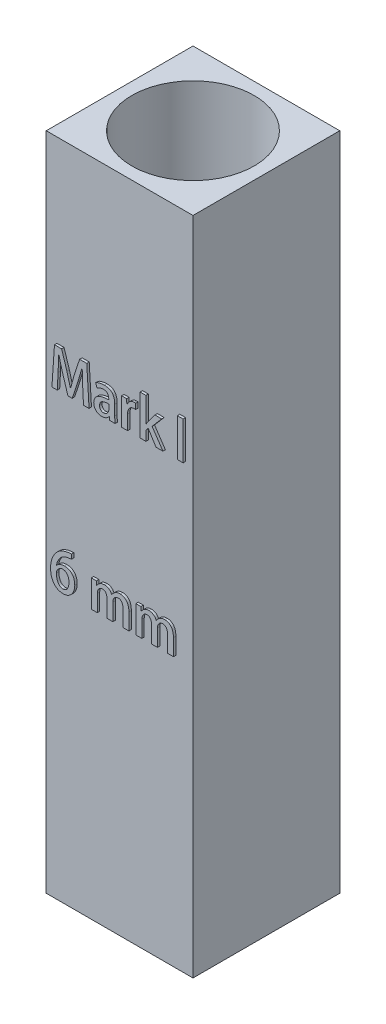
from build123d import *

# Parameters (mm, degrees)
CROQUIS1_W              = 6
CROQUIS1_H              = 6
CROQUIS1_R              = 2.5
SALIENTE_EXTRUIR1_DEPTH = 27
CROQUIS2_2_W            = 0.238171994
CROQUIS2_2_H            = 1.552222222
SALIENTE_EXTRUIR2_DEPTH = 0.1


with BuildPart() as part:
    # Croquis1 → Saliente-Extruir1 (new body)
    with BuildSketch(Plane(origin=(0, 0, 0), x_dir=(1, 0, 0), z_dir=(0, 1, 0))):
        Rectangle(CROQUIS1_W, CROQUIS1_H)
        Circle(CROQUIS1_R, mode=Mode.SUBTRACT)
    extrude(amount=SALIENTE_EXTRUIR1_DEPTH)

    # Croquis2<2> → Saliente-Extruir2 (add)
    # profile 1 of 8: a face of its own
    with BuildSketch(Plane.XY.offset(3)):
        with BuildLine():
            Line((-1.243105258, 19.691333526), (-1.53583583, 19.691333526))
            Line((-1.53583583, 19.691333526), (-1.759926131, 19.009160095))
            add(Edge.make_bspline(
                [(-1.759926131, 19.009160095), (-1.774503705, 18.961969088), (-1.803038041, 18.869596785), (-1.842147714, 18.733006523), (-1.876798216, 18.601332234), (-1.897467062, 18.514910223), (-1.907577821, 18.472634418)],
                knots=[0, 0, 0, 0, 1.06482216, 2.08429696, 3.06287894, 4, 4, 4, 4], degree=3))
            Line((-1.907577821, 18.472634418), (-1.913357327, 18.472634418))
            add(Edge.make_bspline(
                [(-1.913357327, 18.472634418), (-1.923287511, 18.515304168), (-1.943489707, 18.6021125), (-1.977509829, 18.733741597), (-2.014265856, 18.869354234), (-2.041158045, 18.960661279), (-2.054821906, 19.007054186)],
                knots=[0, 0, 0, 0, 0.950771496, 1.934271678, 2.950408035, 4, 4, 4, 4], degree=3))
            Line((-2.054821906, 19.007054186), (-2.272709341, 19.691333526))
            Line((-2.272709341, 19.691333526), (-2.563421082, 19.691333526))
            Line((-2.563421082, 19.691333526), (-2.668436986, 18.141662341))
            Line((-2.668436986, 18.141662341), (-2.450366516, 18.141662341))
            Line((-2.450366516, 18.141662341), (-2.41604638, 18.777478553))
            add(Edge.make_bspline(
                [(-2.41604638, 18.777478553), (-2.412948778, 18.833172848), (-2.406698639, 18.945549135), (-2.400615986, 19.086056436), (-2.395173591, 19.197982767), (-2.392536137, 19.279250732), (-2.389596416, 19.35755157), (-2.388544482, 19.408698047), (-2.388027645, 19.433827381)],
                knots=[0, 0, 0, 0, 1.528265809, 3.083634274, 3.853229214, 4.59840858, 5.311368824, 6, 6, 6, 6], degree=3))
            Line((-2.388027645, 19.433827381), (-2.381726244, 19.433850583))
            add(Edge.make_bspline(
                [(-2.381726244, 19.433850583), (-2.371395386, 19.385870079), (-2.350437115, 19.288531757), (-2.313337232, 19.14176167), (-2.272564393, 18.991726175), (-2.241928921, 18.891313412), (-2.226411129, 18.840451317)],
                knots=[0, 0, 0, 0, 0.959753872, 1.947058171, 2.960122984, 4, 4, 4, 4], degree=3))
            Line((-2.226411129, 18.840451317), (-2.014298904, 18.155854314))
            Line((-2.014298904, 18.155854314), (-1.838660561, 18.155854314))
            Line((-1.838660561, 18.155854314), (-1.608513766, 18.854705734))
            add(Edge.make_bspline(
                [(-1.608513766, 18.854705734), (-1.592363414, 18.904162216), (-1.560380634, 19.00210162), (-1.51600407, 19.148281273), (-1.474748025, 19.291806547), (-1.449552822, 19.386852984), (-1.437100704, 19.433827381)],
                knots=[0, 0, 0, 0, 1.033513873, 2.046682856, 3.034620343, 4, 4, 4, 4], degree=3))
            Line((-1.437100704, 19.433827381), (-1.43085659, 19.433850583))
            add(Edge.make_bspline(
                [(-1.43085659, 19.433850583), (-1.430953507, 19.408910817), (-1.431151116, 19.35805965), (-1.430144835, 19.28051514), (-1.428514077, 19.20033124), (-1.424351207, 19.090633995), (-1.418525422, 18.953360161), (-1.413291565, 18.843675712), (-1.410702362, 18.789414522)],
                knots=[0, 0, 0, 0, 0.69615936, 1.419440619, 2.164688967, 2.934803833, 4.483639269, 6, 6, 6, 6], degree=3))
            Line((-1.410702362, 18.789414522), (-1.376348139, 18.141662341))
            Line((-1.376348139, 18.141662341), (-1.150239007, 18.141662341))
            Line((-1.150239007, 18.141662341), (-1.243105258, 19.691333526))
        make_face()
    # profile 2 of 8: a face of its own
    with BuildSketch(Plane.XY.offset(3)):
        with BuildLine():
            add(Edge.make_bspline(
                [(-0.100758256, 18.817759799), (-0.100739773, 18.833347282), (-0.100703376, 18.864042223), (-0.104324864, 18.909261775), (-0.110699636, 18.952692823), (-0.120020741, 18.994333635), (-0.132742356, 19.034016589), (-0.148219231, 19.071940837), (-0.166862147, 19.107964119), (-0.188351457, 19.142114859), (-0.213892812, 19.173526007), (-0.244145496, 19.201120016), (-0.279192974, 19.224438404), (-0.31896107, 19.243469367), (-0.363276923, 19.258660002), (-0.412114621, 19.269965646), (-0.465526352, 19.277361289), (-0.502672249, 19.278797873), (-0.521958181, 19.279543738)],
                knots=[0, 0, 0, 0, 1.04529413, 2.058397975, 3.039753549, 3.988049356, 4.917306062, 5.832005784, 6.732558164, 7.634995369, 8.534400609, 9.439717093, 10.371077683, 11.347885902, 12.389132223, 13.507522911, 14.705920534, 16, 16, 16, 16], degree=3))
            add(Edge.make_bspline(
                [(-0.521958181, 19.279543738), (-0.539763684, 19.279069767), (-0.574855052, 19.278135656), (-0.626406557, 19.273142892), (-0.675926526, 19.265018234), (-0.722843684, 19.253459127), (-0.766893023, 19.240088594), (-0.807531963, 19.225224612), (-0.844382305, 19.208669369), (-0.866891698, 19.195734993), (-0.877749168, 19.189496061)],
                knots=[0, 0, 0, 0, 1.151566781, 2.269526023, 3.346377101, 4.393757963, 5.391790339, 6.321988655, 7.190606464, 8, 8, 8, 8], degree=3))
            Line((-0.877749168, 19.189496061), (-0.827929172, 19.031316256))
            add(Edge.make_bspline(
                [(-0.827929172, 19.031316256), (-0.818518559, 19.037359562), (-0.79953562, 19.049550023), (-0.769045627, 19.065312965), (-0.736909363, 19.079516835), (-0.702945566, 19.090955508), (-0.668157306, 19.100794685), (-0.632762856, 19.107805863), (-0.596954026, 19.112036125), (-0.57300624, 19.112638227), (-0.560969065, 19.112940869)],
                knots=[0, 0, 0, 0, 0.947728913, 1.911743672, 2.906591377, 3.923705885, 4.947352295, 5.969890554, 6.979580645, 8, 8, 8, 8], degree=3))
            add(Edge.make_bspline(
                [(-0.560969065, 19.112940869), (-0.548619984, 19.112126351), (-0.525048994, 19.110571661), (-0.491779036, 19.104263938), (-0.462255406, 19.095878172), (-0.436252729, 19.085213272), (-0.414224266, 19.07119136), (-0.395800204, 19.054780822), (-0.381225064, 19.03557404), (-0.368278385, 19.006862446), (-0.357184454, 18.970405505), (-0.347402278, 18.927885709), (-0.342887998, 18.887166526), (-0.344170608, 18.860889493), (-0.344795975, 18.848077504)],
                knots=[0, 0, 0, 0, 1.124941475, 2.147203117, 3.073276344, 3.914150165, 4.693859246, 5.436944029, 6.148486199, 6.868538222, 8.288979618, 9.609682438, 10.834544209, 12, 12, 12, 12], degree=3))
            add(Edge.make_bspline(
                [(-0.344795975, 18.848077504), (-0.367484742, 18.847793001), (-0.411831212, 18.847236924), (-0.476588911, 18.842998533), (-0.537682863, 18.835032947), (-0.595163267, 18.824143926), (-0.64923427, 18.810699823), (-0.699533799, 18.793185909), (-0.74643407, 18.773039972), (-0.789591754, 18.749708127), (-0.828620699, 18.723102195), (-0.862637975, 18.692798312), (-0.891321074, 18.658896681), (-0.9155088, 18.62203478), (-0.933912522, 18.581262884), (-0.947792081, 18.537395451), (-0.956370999, 18.489967105), (-0.957911352, 18.457221869), (-0.958704084, 18.440369778)],
                knots=[0, 0, 0, 0, 1.312583045, 2.565517338, 3.751913568, 4.874585872, 5.948775456, 6.97196923, 7.952367169, 8.899011352, 9.80588498, 10.679130641, 11.525793372, 12.368308044, 13.221239438, 14.104974037, 15.024739096, 16, 16, 16, 16], degree=3))
            add(Edge.make_bspline(
                [(-0.958704084, 18.440369778), (-0.958279735, 18.429409478), (-0.957447111, 18.407904049), (-0.953439331, 18.376232764), (-0.946178959, 18.345993553), (-0.937028287, 18.316766551), (-0.924476437, 18.289057162), (-0.909514362, 18.262676674), (-0.892073498, 18.237429503), (-0.871909761, 18.21387715), (-0.849483179, 18.192019903), (-0.824299395, 18.173257681), (-0.797171402, 18.157052786), (-0.767946898, 18.143386876), (-0.736303007, 18.132943931), (-0.702552325, 18.125010036), (-0.666504369, 18.120026571), (-0.641743704, 18.118892734), (-0.629018124, 18.118310006)],
                knots=[0, 0, 0, 0, 1.019558823, 2.000497171, 2.961865832, 3.90763667, 4.843526869, 5.78386522, 6.724423229, 7.691661655, 8.662438953, 9.629634663, 10.603980382, 11.596308817, 12.622532153, 13.696327026, 14.81604254, 16, 16, 16, 16], degree=3))
            add(Edge.make_bspline(
                [(-0.629018124, 18.118310006), (-0.61264805, 18.118865547), (-0.580673264, 18.119950655), (-0.534513933, 18.128623757), (-0.491080825, 18.140921365), (-0.451201641, 18.158999118), (-0.414991177, 18.181101137), (-0.382021185, 18.2057859), (-0.352929271, 18.233708521), (-0.336724437, 18.254779449), (-0.328663655, 18.265260776)],
                knots=[0, 0, 0, 0, 1.130657597, 2.208452709, 3.237069398, 4.244418774, 5.223812689, 6.164576675, 7.087004055, 8, 8, 8, 8], degree=3))
            Line((-0.328663655, 18.265260776), (-0.3220592, 18.265318351))
            Line((-0.3220592, 18.265318351), (-0.305198176, 18.13987123))
            Line((-0.305198176, 18.13987123), (-0.084538858, 18.13987123))
            add(Edge.make_bspline(
                [(-0.084538858, 18.13987123), (-0.087703938, 18.158850164), (-0.094387748, 18.198928641), (-0.098553622, 18.262467157), (-0.100837119, 18.330648578), (-0.10097902, 18.377499617), (-0.101051284, 18.401358895)],
                knots=[0, 0, 0, 0, 0.879539962, 1.857355241, 2.908840502, 4, 4, 4, 4], degree=3))
            Line((-0.101051284, 18.401358895), (-0.100758256, 18.817759799))
        make_face()
        with BuildLine():
            add(Edge.make_bspline(
                [(-0.338929963, 18.514069733), (-0.339371797, 18.505816524), (-0.340231548, 18.489756839), (-0.343924426, 18.466308526), (-0.348963362, 18.444023954), (-0.356554839, 18.42301308), (-0.365504124, 18.402939642), (-0.376798214, 18.384174666), (-0.389718323, 18.366376051), (-0.404706047, 18.350100626), (-0.420944917, 18.335199447), (-0.438420368, 18.32226415), (-0.456587202, 18.310987342), (-0.475909169, 18.301872267), (-0.496194495, 18.294439671), (-0.517553822, 18.289264654), (-0.539851213, 18.285967026), (-0.554993736, 18.285269295), (-0.562728954, 18.284912875)],
                knots=[0, 0, 0, 0, 1.1127689, 2.165305488, 3.194083487, 4.185588777, 5.169981375, 6.15040018, 7.13046498, 8.12816315, 9.12586132, 10.095335325, 11.053196287, 12.001774197, 12.968470205, 13.958837393, 14.957317833, 16, 16, 16, 16], degree=3))
            add(Edge.make_bspline(
                [(-0.562728954, 18.284912875), (-0.573154956, 18.285239843), (-0.593577379, 18.285880307), (-0.622849474, 18.2946148), (-0.649773059, 18.308312857), (-0.674150955, 18.327453399), (-0.694562833, 18.352948212), (-0.70918768, 18.384928439), (-0.718234509, 18.422875733), (-0.719543136, 18.450189505), (-0.720239061, 18.464714916)],
                knots=[0, 0, 0, 0, 0.925162071, 1.812204857, 2.691873356, 3.602553412, 4.549923018, 5.56994314, 6.707700436, 8, 8, 8, 8], degree=3))
            add(Edge.make_bspline(
                [(-0.720239061, 18.464714916), (-0.719310255, 18.476377608), (-0.717516348, 18.498903076), (-0.710939574, 18.531156202), (-0.700200796, 18.560193715), (-0.686429825, 18.586246768), (-0.669258814, 18.609393378), (-0.648007519, 18.628738379), (-0.623750563, 18.645518844), (-0.586423919, 18.662613003), (-0.536106387, 18.678760546), (-0.473048416, 18.692622909), (-0.406968805, 18.700130184), (-0.362119208, 18.700013197), (-0.339222992, 18.699953474)],
                knots=[0, 0, 0, 0, 0.831751151, 1.606454387, 2.332498033, 3.02628555, 3.696675427, 4.370806108, 5.061344671, 5.786088267, 7.281491765, 8.811961156, 10.372470837, 12, 12, 12, 12], degree=3))
            Line((-0.339222992, 18.699953474), (-0.338929963, 18.514069733))
        make_face(mode=Mode.SUBTRACT)
    # profile 3 of 8: a face of its own
    with BuildSketch(Plane.XY.offset(3)):
        with BuildLine():
            add(Edge.make_bspline(
                [(0.751277735, 19.273806338), (0.741733822, 19.275463651), (0.722241357, 19.278848542), (0.702461024, 19.279308821), (0.69236555, 19.279543738)],
                knots=[0, 0, 0, 0, 0.97924127, 2, 2, 2, 2], degree=3))
            add(Edge.make_bspline(
                [(0.69236555, 19.279543738), (0.677041737, 19.278706709), (0.646649215, 19.277046586), (0.602157925, 19.265098289), (0.559859382, 19.245645191), (0.519748189, 19.219466361), (0.482560598, 19.187026209), (0.450650863, 19.147674619), (0.422706361, 19.10301482), (0.409218529, 19.069869394), (0.402277103, 19.052811312)],
                knots=[0, 0, 0, 0, 0.938175605, 1.860732817, 2.801619752, 3.780189859, 4.786007179, 5.811395864, 6.873648904, 8, 8, 8, 8], degree=3))
            Line((0.402277103, 19.052811312), (0.394064285, 19.052862299))
            Line((0.394064285, 19.052862299), (0.385851468, 19.255732239))
            Line((0.385851468, 19.255732239), (0.178580658, 19.255732239))
            add(Edge.make_bspline(
                [(0.178580658, 19.255732239), (0.179929699, 19.229747095), (0.182683519, 19.176703171), (0.184764449, 19.094861948), (0.186412593, 19.007941051), (0.186402548, 18.948098882), (0.186397328, 18.917006508)],
                knots=[0, 0, 0, 0, 0.921405029, 1.880880017, 2.898962507, 4, 4, 4, 4], degree=3))
            Line((0.186397328, 18.917006508), (0.186690357, 18.140521163))
            Line((0.186690357, 18.140521163), (0.424862351, 18.140521163))
            Line((0.424862351, 18.140521163), (0.424862351, 18.732529189))
            add(Edge.make_bspline(
                [(0.424862351, 18.732529189), (0.425227549, 18.744554826), (0.425938591, 18.767968787), (0.429042586, 18.802198873), (0.434636496, 18.834442383), (0.442244094, 18.864856481), (0.451959425, 18.89339884), (0.463546958, 18.920254795), (0.477783639, 18.944852342), (0.493604518, 18.967681884), (0.511459007, 18.988076857), (0.530809444, 19.006277215), (0.552300155, 19.021240054), (0.575090356, 19.034026553), (0.599761053, 19.043558857), (0.625708699, 19.051114824), (0.653409693, 19.055443295), (0.672406187, 19.056225348), (0.682099528, 19.056624406)],
                knots=[0, 0, 0, 0, 1.241840886, 2.417868999, 3.544527356, 4.616704577, 5.650820151, 6.654086497, 7.630544836, 8.5797601, 9.516878827, 10.423948895, 11.314471818, 12.213419717, 13.114913654, 14.038234368, 14.998969914, 16, 16, 16, 16], degree=3))
            add(Edge.make_bspline(
                [(0.682099528, 19.056624406), (0.694348105, 19.056443835), (0.717466493, 19.056103018), (0.740295012, 19.05246747), (0.751028532, 19.050758108)],
                knots=[0, 0, 0, 0, 1.059639438, 2, 2, 2, 2], degree=3))
            Line((0.751028532, 19.050758108), (0.751277735, 19.273806338))
        make_face()
    # profile 4 of 8: a face of its own
    with BuildSketch(Plane.XY.offset(3)):
        with BuildLine():
            Line((1.427149192, 18.796284507), (1.820469592, 19.256900056))
            Line((1.820469592, 19.256900056), (1.542712402, 19.256900056))
            Line((1.542712402, 19.256900056), (1.264955212, 18.883537673))
            add(Edge.make_bspline(
                [(1.264955212, 18.883537673), (1.250285677, 18.862454076), (1.220679155, 18.819902489), (1.193349757, 18.775853538), (1.179561617, 18.753630103)],
                knots=[0, 0, 0, 0, 0.99096644, 2, 2, 2, 2], degree=3))
            Line((1.179561617, 18.753630103), (1.175748523, 18.753672496))
            Line((1.175748523, 18.753672496), (1.175748523, 19.766152889))
            Line((1.175748523, 19.766152889), (0.937576529, 19.766152889))
            Line((0.937576529, 19.766152889), (0.937576529, 18.13884205))
            Line((0.937576529, 18.13884205), (1.175748523, 18.13884205))
            Line((1.175748523, 18.13884205), (1.175748523, 18.54061244))
            Line((1.175748523, 18.54061244), (1.266982637, 18.652215327))
            Line((1.266982637, 18.652215327), (1.587315746, 18.13884205))
            Line((1.587315746, 18.13884205), (1.871155211, 18.13884205))
            Line((1.871155211, 18.13884205), (1.427149192, 18.796284507))
        make_face()
    # profile 5 of 8: a face of its own
    with BuildSketch(Plane.XY.offset(3)):
        with Locations((2.577207024, 18.914953161)):
            Rectangle(CROQUIS2_2_W, CROQUIS2_2_H)
    # profile 6 of 8: a face of its own
    with BuildSketch(Plane.XY.offset(3)):
        with BuildLine():
            add(Edge.make_bspline(
                [(-2.480889026, 11.9222523), (-2.479041686, 11.936342955), (-2.475309643, 11.964809261), (-2.46474607, 12.00713304), (-2.450552354, 12.049422287), (-2.433014341, 12.091776695), (-2.411328979, 12.133761982), (-2.386390526, 12.175876989), (-2.357415313, 12.217777693), (-2.325352855, 12.2597275), (-2.288494636, 12.299522465), (-2.245433982, 12.334410494), (-2.196814745, 12.364126731), (-2.142733216, 12.389046194), (-2.083257409, 12.409257188), (-2.018286905, 12.424262755), (-1.947978563, 12.43501444), (-1.899110741, 12.437813826), (-1.873846606, 12.439261078)],
                knots=[0, 0, 0, 0, 0.777509649, 1.570745206, 2.383233953, 3.218261332, 4.077671974, 4.968127196, 5.896067489, 6.865046429, 7.857167727, 8.857843751, 9.888812526, 10.968872827, 12.111466473, 13.321517165, 14.615253401, 16, 16, 16, 16], degree=3))
            Line((-1.873846606, 12.439261078), (-1.875606782, 12.623902528))
            add(Edge.make_bspline(
                [(-1.875606782, 12.623902528), (-1.902720762, 12.623262343), (-1.956849823, 12.621984308), (-2.037751847, 12.611349791), (-2.118031791, 12.593728685), (-2.184010857, 12.573005662), (-2.235798191, 12.552954572), (-2.27360479, 12.535507933), (-2.310014788, 12.515973979), (-2.345287469, 12.494353075), (-2.379199894, 12.470680539), (-2.411926915, 12.444737484), (-2.44324992, 12.416596699), (-2.463114974, 12.396536412), (-2.473088969, 12.386464394)],
                knots=[0, 0, 0, 0, 1.475963964, 2.94654425, 4.434636167, 5.946695683, 6.706959259, 7.457316209, 8.212361229, 8.955602033, 9.708824246, 10.462949018, 11.228265963, 12, 12, 12, 12], degree=3))
            add(Edge.make_bspline(
                [(-2.473088969, 12.386464394), (-2.482393486, 12.37619807), (-2.501041839, 12.355622038), (-2.52711471, 12.322793764), (-2.55219373, 12.288649487), (-2.575148367, 12.252341118), (-2.59740506, 12.214908142), (-2.617489193, 12.175359017), (-2.636577187, 12.134412089), (-2.654186297, 12.091876025), (-2.670102922, 12.047879005), (-2.683809213, 12.002207453), (-2.69592505, 11.955193025), (-2.705515778, 11.906597509), (-2.71315677, 11.856687228), (-2.718690066, 11.805209017), (-2.722271896, 11.752268806), (-2.722946107, 11.716440951), (-2.723286588, 11.698347613)],
                knots=[0, 0, 0, 0, 0.887076062, 1.777900753, 2.683391647, 3.598700782, 4.527593784, 5.471309146, 6.437764931, 7.420312658, 8.418516269, 9.432655989, 10.472901406, 11.526478087, 12.603278601, 13.705447861, 14.841233787, 16, 16, 16, 16], degree=3))
            add(Edge.make_bspline(
                [(-2.723286588, 11.698347613), (-2.722724699, 11.674278175), (-2.721628386, 11.627315775), (-2.714693561, 11.558738759), (-2.704184634, 11.493854475), (-2.688709355, 11.43294789), (-2.669902859, 11.375660204), (-2.646216637, 11.322488036), (-2.619017122, 11.272762739), (-2.587328444, 11.227442658), (-2.552201435, 11.186378973), (-2.51324497, 11.150707354), (-2.471039565, 11.12023013), (-2.425521531, 11.095176429), (-2.376830571, 11.075307106), (-2.324754515, 11.061510159), (-2.26957391, 11.051982088), (-2.231536898, 11.05055823), (-2.212038698, 11.049828345)],
                knots=[0, 0, 0, 0, 1.244240003, 2.427663509, 3.56025608, 4.639046522, 5.673196192, 6.673439109, 7.644022454, 8.598895837, 9.527068602, 10.432163715, 11.32293322, 12.212023313, 13.112150977, 14.03423449, 14.992326474, 16, 16, 16, 16], degree=3))
            add(Edge.make_bspline(
                [(-2.212038698, 11.049828345), (-2.193914698, 11.0507327), (-2.158455315, 11.052502058), (-2.106919701, 11.061296596), (-2.058270731, 11.073972861), (-2.012713907, 11.09172226), (-1.970313629, 11.114082814), (-1.93091643, 11.141012218), (-1.894622185, 11.172634149), (-1.861757801, 11.208665131), (-1.832232289, 11.247934395), (-1.806239934, 11.289669982), (-1.784512889, 11.333950328), (-1.766628317, 11.380396873), (-1.752470465, 11.429063175), (-1.742316053, 11.479990926), (-1.735633268, 11.533134669), (-1.734701787, 11.569366515), (-1.734228708, 11.587767892)],
                knots=[0, 0, 0, 0, 1.081673944, 2.116281853, 3.112274727, 4.076244858, 5.025922624, 5.965842859, 6.916701973, 7.890887246, 8.869584152, 9.843944007, 10.819490191, 11.807320738, 12.809578423, 13.839044245, 14.902496982, 16, 16, 16, 16], degree=3))
            add(Edge.make_bspline(
                [(-1.734228708, 11.587767892), (-1.734835703, 11.606557434), (-1.736014986, 11.643062197), (-1.742242815, 11.696016437), (-1.75183553, 11.745467961), (-1.764877457, 11.791533184), (-1.782043247, 11.833875783), (-1.802274579, 11.873073448), (-1.826349189, 11.908571776), (-1.853805361, 11.940471334), (-1.884132035, 11.968499322), (-1.916325377, 11.993417126), (-1.951041915, 12.013937788), (-1.987584933, 12.031220688), (-2.026529372, 12.044244293), (-2.067414329, 12.054101656), (-2.11050109, 12.059593828), (-2.139868677, 12.060448879), (-2.154842291, 12.060884843)],
                knots=[0, 0, 0, 0, 1.26296684, 2.453721526, 3.578700088, 4.645529679, 5.665582436, 6.644269457, 7.604699112, 8.541184806, 9.466353035, 10.375777277, 11.271641363, 12.171136678, 13.087489562, 14.026208577, 14.993625547, 16, 16, 16, 16], degree=3))
            add(Edge.make_bspline(
                [(-2.154842291, 12.060884843), (-2.172275559, 12.060268806), (-2.206235737, 12.05906876), (-2.255494634, 12.051277663), (-2.301508132, 12.039128192), (-2.343936731, 12.021996403), (-2.382503427, 12.000943232), (-2.418053102, 11.977912024), (-2.449764296, 11.951708864), (-2.468111319, 11.931936614), (-2.477195378, 11.92214689)],
                knots=[0, 0, 0, 0, 1.156440373, 2.252757208, 3.300703977, 4.307699385, 5.279936465, 6.211868705, 7.114652551, 8, 8, 8, 8], degree=3))
            Line((-2.477195378, 11.92214689), (-2.480889026, 11.9222523))
        make_face()
        with BuildLine():
            add(Edge.make_bspline(
                [(-2.211765148, 11.216431214), (-2.222449864, 11.217027407), (-2.243218733, 11.218186281), (-2.273125424, 11.22460629), (-2.301225848, 11.233961342), (-2.327375495, 11.247249248), (-2.351663278, 11.264118389), (-2.373817424, 11.28467184), (-2.394128901, 11.308638217), (-2.412514649, 11.335935913), (-2.428739235, 11.366112861), (-2.443178471, 11.39855375), (-2.455583506, 11.433229745), (-2.465263589, 11.470306417), (-2.47374491, 11.509396793), (-2.479262766, 11.550901682), (-2.483659234, 11.59452362), (-2.484428704, 11.624420449), (-2.484821565, 11.639684631)],
                knots=[0, 0, 0, 0, 0.915864629, 1.78025069, 2.61227226, 3.447914443, 4.2846901, 5.138616198, 6.030190831, 6.971411356, 7.953766446, 8.962775595, 10.012269494, 11.105795088, 12.244640674, 13.437916411, 14.69189769, 16, 16, 16, 16], degree=3))
            add(Edge.make_bspline(
                [(-2.484821565, 11.639684631), (-2.4843096, 11.648697714), (-2.483291353, 11.666623803), (-2.478760518, 11.692809371), (-2.47236593, 11.718218115), (-2.46322097, 11.742426073), (-2.451848912, 11.765765312), (-2.438960929, 11.788522372), (-2.422620648, 11.809571145), (-2.405120417, 11.830079746), (-2.385558073, 11.848487713), (-2.365391792, 11.865206721), (-2.343968924, 11.878936557), (-2.322063342, 11.890919052), (-2.298904392, 11.899866765), (-2.275234928, 11.907064208), (-2.250616631, 11.911511085), (-2.233956138, 11.912535896), (-2.225531184, 11.913054128)],
                knots=[0, 0, 0, 0, 1.046132762, 2.080649706, 3.076157144, 4.0807274, 5.074684002, 6.085886841, 7.106328067, 8.159075787, 9.209623149, 10.217196229, 11.192086732, 12.15583678, 13.107505917, 14.065368779, 15.02168697, 16, 16, 16, 16], degree=3))
            add(Edge.make_bspline(
                [(-2.225531184, 11.913054128), (-2.215929131, 11.912692739), (-2.197194701, 11.911987637), (-2.169924059, 11.907156747), (-2.144341023, 11.899553238), (-2.12033903, 11.889168919), (-2.097819822, 11.876186314), (-2.076865069, 11.860281438), (-2.057785517, 11.841257094), (-2.040218686, 11.819826245), (-2.024320056, 11.796141632), (-2.010921567, 11.770026009), (-1.999120597, 11.742126429), (-1.989426164, 11.712209119), (-1.98224286, 11.6801642), (-1.976560897, 11.646305495), (-1.973484898, 11.610309196), (-1.972768179, 11.58571958), (-1.972400416, 11.573102146)],
                knots=[0, 0, 0, 0, 0.969557164, 1.891689275, 2.788354305, 3.659703236, 4.526901527, 5.407766989, 6.308555138, 7.241672595, 8.202997831, 9.183555995, 10.201442537, 11.260090598, 12.3547857, 13.515543957, 14.725174941, 16, 16, 16, 16], degree=3))
            add(Edge.make_bspline(
                [(-1.972400416, 11.573102146), (-1.972628062, 11.560285705), (-1.973073665, 11.535198293), (-1.976487066, 11.498496813), (-1.98124193, 11.463576339), (-1.988426948, 11.430599991), (-1.997051695, 11.399444536), (-2.00796272, 11.370204164), (-2.0209569, 11.342910779), (-2.035384732, 11.317410853), (-2.051899003, 11.294403512), (-2.06996039, 11.274082751), (-2.089835617, 11.256914724), (-2.111151464, 11.242589297), (-2.134189549, 11.231465201), (-2.158687824, 11.223121109), (-2.184868058, 11.218167766), (-2.20282845, 11.217019867), (-2.211765148, 11.216431214)],
                knots=[0, 0, 0, 0, 1.284412311, 2.514159745, 3.692212462, 4.814741848, 5.894356042, 6.930111876, 7.938380453, 8.921766342, 9.862780727, 10.771869383, 11.640326944, 12.488361832, 13.338658754, 14.197105583, 15.075459788, 16, 16, 16, 16], degree=3))
        make_face(mode=Mode.SUBTRACT)
    # profile 7 of 8: a face of its own
    with BuildSketch(Plane.XY.offset(3)):
        with BuildLine():
            add(Edge.make_bspline(
                [(0.481178528, 11.752717427), (0.480250218, 11.773330005), (0.478458461, 11.813114954), (0.471908088, 11.870369922), (0.462932743, 11.923044647), (0.449928572, 11.970688456), (0.434305673, 12.013583133), (0.41514704, 12.051523086), (0.392817766, 12.084778382), (0.367147428, 12.113035136), (0.339265255, 12.136538605), (0.311083182, 12.15738016), (0.281954473, 12.174667253), (0.252209031, 12.188977487), (0.221508429, 12.199663032), (0.18997037, 12.206461937), (0.157881868, 12.210979164), (0.136255806, 12.210839133), (0.125387827, 12.210768762)],
                knots=[0, 0, 0, 0, 1.513261231, 2.920790482, 4.225039661, 5.429095985, 6.538902965, 7.568588871, 8.539409605, 9.468669045, 10.358677973, 11.210859535, 12.037483604, 12.839564471, 13.628941055, 14.4154775, 15.203712731, 16, 16, 16, 16], degree=3))
            add(Edge.make_bspline(
                [(0.125387827, 12.210768762), (0.106172097, 12.210010119), (0.068922136, 12.208539477), (0.015398149, 12.1979582), (-0.034067301, 12.181710227), (-0.078938979, 12.158196445), (-0.119501153, 12.128929209), (-0.15716339, 12.095784573), (-0.190846372, 12.057263465), (-0.210072807, 12.028742391), (-0.219843823, 12.014247772)],
                knots=[0, 0, 0, 0, 1.108126197, 2.148118191, 3.136426768, 4.10280475, 5.057637098, 6.016626622, 6.992035069, 8, 8, 8, 8], degree=3))
            Line((-0.219843823, 12.014247772), (-0.223900678, 12.01425522))
            add(Edge.make_bspline(
                [(-0.223900678, 12.01425522), (-0.23051503, 12.028960136), (-0.243458943, 12.057736822), (-0.270221955, 12.096430721), (-0.301804378, 12.130085462), (-0.338126016, 12.158756512), (-0.37865322, 12.181726908), (-0.42302607, 12.19815049), (-0.470614691, 12.208844564), (-0.503616136, 12.210117725), (-0.520491607, 12.210768762)],
                knots=[0, 0, 0, 0, 1.020955632, 1.99795227, 2.96752067, 3.938931661, 4.92195175, 5.909051468, 6.930781959, 8, 8, 8, 8], degree=3))
            add(Edge.make_bspline(
                [(-0.520491607, 12.210768762), (-0.539807301, 12.209702295), (-0.576794642, 12.207660131), (-0.629518562, 12.196764914), (-0.676658377, 12.179323987), (-0.717685666, 12.155042435), (-0.753314912, 12.127031078), (-0.784631271, 12.096943481), (-0.811832558, 12.065039339), (-0.826119994, 12.041630138), (-0.833165302, 12.030086777)],
                knots=[0, 0, 0, 0, 1.224631561, 2.345029053, 3.39800305, 4.394808606, 5.352867572, 6.264332918, 7.144121535, 8, 8, 8, 8], degree=3))
            Line((-0.833165302, 12.030086777), (-0.839171383, 12.030303899))
            Line((-0.839171383, 12.030303899), (-0.851707158, 12.187611206))
            Line((-0.851707158, 12.187611206), (-1.060381526, 12.187611206))
            add(Edge.make_bspline(
                [(-1.060381526, 12.187611206), (-1.059414195, 12.164630929), (-1.057438749, 12.117701485), (-1.055311823, 12.058151312), (-1.053539288, 12.008096905), (-1.053221587, 11.96770734), (-1.052384747, 11.924789497), (-1.052503636, 11.895357949), (-1.052564855, 11.880202858)],
                knots=[0, 0, 0, 0, 1.346187736, 2.749133221, 3.487683855, 4.277464658, 5.113020504, 6, 6, 6, 6], degree=3))
            Line((-1.052564855, 11.880202858), (-1.052271827, 11.077584987))
            Line((-1.052271827, 11.077584987), (-0.814099833, 11.077584987))
            Line((-0.814099833, 11.077584987), (-0.814099833, 11.754744852))
            add(Edge.make_bspline(
                [(-0.814099833, 11.754744852), (-0.813559324, 11.765485168), (-0.812508444, 11.786366936), (-0.808597663, 11.81660408), (-0.80330372, 11.844967147), (-0.795165935, 11.87117417), (-0.785595702, 11.895565824), (-0.774157833, 11.918066953), (-0.760615307, 11.938482205), (-0.745010043, 11.956558115), (-0.728325948, 11.972537102), (-0.71130617, 11.986712516), (-0.693895255, 11.998883128), (-0.675982901, 12.008961095), (-0.657462851, 12.016657906), (-0.638495039, 12.021771267), (-0.619298615, 12.025657705), (-0.606257273, 12.026067311), (-0.599686633, 12.026273683)],
                knots=[0, 0, 0, 0, 1.345028047, 2.615059288, 3.812240957, 4.950008049, 6.042686379, 7.08768926, 8.102172383, 9.099996684, 10.068982838, 10.989984122, 11.868914175, 12.723236376, 13.556990843, 14.370301474, 15.178906315, 16, 16, 16, 16], degree=3))
            add(Edge.make_bspline(
                [(-0.599686633, 12.026273683), (-0.591846108, 12.025870767), (-0.576645118, 12.025089605), (-0.554768506, 12.020925909), (-0.534559479, 12.014442832), (-0.515892796, 12.005589596), (-0.498879057, 11.994378136), (-0.483255932, 11.981073158), (-0.469899453, 11.964975768), (-0.453515011, 11.940681202), (-0.437676673, 11.905380458), (-0.423296398, 11.858643916), (-0.41573985, 11.806236414), (-0.414801199, 11.76964393), (-0.414311609, 11.750557667)],
                knots=[0, 0, 0, 0, 0.755950668, 1.465615932, 2.139074498, 2.796588983, 3.449971736, 4.097964407, 4.76639413, 5.458962618, 6.917416126, 8.473425038, 10.160574856, 12, 12, 12, 12], degree=3))
            Line((-0.414311609, 11.750557667), (-0.414018581, 11.077584987))
            Line((-0.414018581, 11.077584987), (-0.175846873, 11.077584987))
            Line((-0.175846873, 11.077584987), (-0.175846873, 11.766909401))
            add(Edge.make_bspline(
                [(-0.175846873, 11.766909401), (-0.175554103, 11.776824966), (-0.174984418, 11.796119114), (-0.170881518, 11.8241438), (-0.165489614, 11.850682557), (-0.157855297, 11.875498525), (-0.148522616, 11.898676754), (-0.136878517, 11.919868398), (-0.123777742, 11.93970964), (-0.108512652, 11.957434401), (-0.091987327, 11.973288699), (-0.074883714, 11.987319278), (-0.057092262, 11.999193194), (-0.038754834, 12.008995495), (-0.019788319, 12.016662106), (-5.4304e-05, 12.021849928), (0.020042772, 12.025628549), (0.033758242, 12.026058558), (0.040619818, 12.026273683)],
                knots=[0, 0, 0, 0, 1.267233675, 2.465839704, 3.615673463, 4.726804397, 5.780700789, 6.804285049, 7.813184962, 8.815168933, 9.787633234, 10.738404153, 11.639821434, 12.517791614, 13.392909498, 14.248069017, 15.123543946, 16, 16, 16, 16], degree=3))
            add(Edge.make_bspline(
                [(0.040619818, 12.026273683), (0.049137559, 12.025851873), (0.065684121, 12.025032465), (0.089729577, 12.021098881), (0.111710186, 12.013760283), (0.132372537, 12.004978951), (0.150604057, 11.992479055), (0.167585203, 11.978237051), (0.182294019, 11.960789), (0.195418347, 11.941187348), (0.206839253, 11.919420014), (0.216436232, 11.89565541), (0.225012615, 11.870250408), (0.231737634, 11.842871267), (0.236501625, 11.813713104), (0.240506798, 11.782821651), (0.242428206, 11.749996087), (0.242617011, 11.727485343), (0.242713791, 11.715946508)],
                knots=[0, 0, 0, 0, 0.979325905, 1.902438322, 2.786756391, 3.636233264, 4.470958944, 5.315074409, 6.175027208, 7.081388835, 8.020752095, 8.99258041, 10.022434341, 11.098284182, 12.226320848, 13.414468146, 14.674676153, 16, 16, 16, 16], degree=3))
            Line((0.242713791, 11.715946508), (0.243006533, 11.077584987))
            Line((0.243006533, 11.077584987), (0.481178528, 11.077584987))
            Line((0.481178528, 11.077584987), (0.481178528, 11.752717427))
        make_face()
    # profile 8 of 8: a face of its own
    with BuildSketch(Plane.XY.offset(3)):
        with BuildLine():
            add(Edge.make_bspline(
                [(2.302077495, 11.752717427), (2.301149185, 11.773330005), (2.299357428, 11.813114954), (2.292807055, 11.870369922), (2.28383171, 11.923044647), (2.270827539, 11.970688456), (2.25520464, 12.013583133), (2.236046007, 12.051523086), (2.213716733, 12.084778382), (2.188046395, 12.113035136), (2.160164222, 12.136538605), (2.131982149, 12.15738016), (2.10285344, 12.174667253), (2.073107998, 12.188977487), (2.042407396, 12.199663032), (2.010869337, 12.206461937), (1.978780835, 12.210979164), (1.957154773, 12.210839133), (1.946286794, 12.210768762)],
                knots=[0, 0, 0, 0, 1.513261231, 2.920790482, 4.225039661, 5.429095985, 6.538902965, 7.568588871, 8.539409605, 9.468669045, 10.358677973, 11.210859535, 12.037483604, 12.839564471, 13.628941055, 14.4154775, 15.203712731, 16, 16, 16, 16], degree=3))
            add(Edge.make_bspline(
                [(1.946286794, 12.210768762), (1.927071064, 12.210010119), (1.889821103, 12.208539477), (1.836297116, 12.1979582), (1.786831667, 12.181710227), (1.741959988, 12.158196445), (1.701397814, 12.128929209), (1.663735577, 12.095784573), (1.630052595, 12.057263465), (1.61082616, 12.028742391), (1.601055144, 12.014247772)],
                knots=[0, 0, 0, 0, 1.108126197, 2.148118191, 3.136426768, 4.10280475, 5.057637098, 6.016626622, 6.992035069, 8, 8, 8, 8], degree=3))
            Line((1.601055144, 12.014247772), (1.596998289, 12.01425522))
            add(Edge.make_bspline(
                [(1.596998289, 12.01425522), (1.590383937, 12.028960136), (1.577440024, 12.057736822), (1.550677012, 12.096430721), (1.519094589, 12.130085462), (1.482772951, 12.158756512), (1.442245747, 12.181726908), (1.397872897, 12.19815049), (1.350284276, 12.208844564), (1.317282831, 12.210117725), (1.30040736, 12.210768762)],
                knots=[0, 0, 0, 0, 1.020955632, 1.99795227, 2.96752067, 3.938931661, 4.92195175, 5.909051468, 6.930781959, 8, 8, 8, 8], degree=3))
            add(Edge.make_bspline(
                [(1.30040736, 12.210768762), (1.281091666, 12.209702295), (1.244104325, 12.207660131), (1.191380405, 12.196764914), (1.14424059, 12.179323987), (1.103213301, 12.155042435), (1.067584055, 12.127031078), (1.036267696, 12.096943481), (1.009066409, 12.065039339), (0.994778973, 12.041630138), (0.987733665, 12.030086777)],
                knots=[0, 0, 0, 0, 1.224631561, 2.345029053, 3.39800305, 4.394808606, 5.352867572, 6.264332918, 7.144121535, 8, 8, 8, 8], degree=3))
            Line((0.987733665, 12.030086777), (0.981727584, 12.030303899))
            Line((0.981727584, 12.030303899), (0.969191809, 12.187611206))
            Line((0.969191809, 12.187611206), (0.760517441, 12.187611206))
            add(Edge.make_bspline(
                [(0.760517441, 12.187611206), (0.761484772, 12.164630929), (0.763460218, 12.117701485), (0.765587144, 12.058151312), (0.767359679, 12.008096905), (0.76767738, 11.96770734), (0.76851422, 11.924789497), (0.768395331, 11.895357949), (0.768334112, 11.880202858)],
                knots=[0, 0, 0, 0, 1.346187736, 2.749133221, 3.487683855, 4.277464658, 5.113020504, 6, 6, 6, 6], degree=3))
            Line((0.768334112, 11.880202858), (0.76862714, 11.077584987))
            Line((0.76862714, 11.077584987), (1.006799134, 11.077584987))
            Line((1.006799134, 11.077584987), (1.006799134, 11.754744852))
            add(Edge.make_bspline(
                [(1.006799134, 11.754744852), (1.007339643, 11.765485168), (1.008390523, 11.786366936), (1.012301304, 11.81660408), (1.017595247, 11.844967147), (1.025733032, 11.87117417), (1.035303266, 11.895565824), (1.046741134, 11.918066953), (1.06028366, 11.938482205), (1.075888924, 11.956558115), (1.092573019, 11.972537102), (1.109592797, 11.986712516), (1.127003712, 11.998883128), (1.144916066, 12.008961095), (1.163436116, 12.016657906), (1.182403928, 12.021771267), (1.201600352, 12.025657705), (1.214641694, 12.026067311), (1.221212334, 12.026273683)],
                knots=[0, 0, 0, 0, 1.345028047, 2.615059288, 3.812240957, 4.950008049, 6.042686379, 7.08768926, 8.102172383, 9.099996684, 10.068982838, 10.989984122, 11.868914175, 12.723236376, 13.556990843, 14.370301474, 15.178906315, 16, 16, 16, 16], degree=3))
            add(Edge.make_bspline(
                [(1.221212334, 12.026273683), (1.229052859, 12.025870767), (1.244253849, 12.025089605), (1.266130461, 12.020925909), (1.286339488, 12.014442832), (1.305006171, 12.005589596), (1.32201991, 11.994378136), (1.337643036, 11.981073158), (1.350999514, 11.964975768), (1.367383956, 11.940681202), (1.383222294, 11.905380458), (1.397602569, 11.858643916), (1.405159118, 11.806236414), (1.406097768, 11.76964393), (1.406587358, 11.750557667)],
                knots=[0, 0, 0, 0, 0.755950668, 1.465615932, 2.139074498, 2.796588983, 3.449971736, 4.097964407, 4.76639413, 5.458962618, 6.917416126, 8.473425038, 10.160574856, 12, 12, 12, 12], degree=3))
            Line((1.406587358, 11.750557667), (1.406880386, 11.077584987))
            Line((1.406880386, 11.077584987), (1.645052094, 11.077584987))
            Line((1.645052094, 11.077584987), (1.645052094, 11.766909401))
            add(Edge.make_bspline(
                [(1.645052094, 11.766909401), (1.645344864, 11.776824966), (1.645914549, 11.796119114), (1.650017449, 11.8241438), (1.655409353, 11.850682557), (1.66304367, 11.875498525), (1.672376351, 11.898676754), (1.68402045, 11.919868398), (1.697121226, 11.93970964), (1.712386315, 11.957434401), (1.72891164, 11.973288699), (1.746015253, 11.987319278), (1.763806705, 11.999193194), (1.782144134, 12.008995495), (1.801110648, 12.016662106), (1.820844663, 12.021849928), (1.840941739, 12.025628549), (1.854657209, 12.026058558), (1.861518785, 12.026273683)],
                knots=[0, 0, 0, 0, 1.267233675, 2.465839704, 3.615673463, 4.726804397, 5.780700789, 6.804285049, 7.813184962, 8.815168933, 9.787633234, 10.738404153, 11.639821434, 12.517791614, 13.392909498, 14.248069017, 15.123543946, 16, 16, 16, 16], degree=3))
            add(Edge.make_bspline(
                [(1.861518785, 12.026273683), (1.870036526, 12.025851873), (1.886583088, 12.025032465), (1.910628545, 12.021098881), (1.932609153, 12.013760283), (1.953271504, 12.004978951), (1.971503024, 11.992479055), (1.98848417, 11.978237051), (2.003192986, 11.960789), (2.016317314, 11.941187348), (2.027738221, 11.919420014), (2.037335199, 11.89565541), (2.045911582, 11.870250408), (2.052636601, 11.842871267), (2.057400592, 11.813713104), (2.061405765, 11.782821651), (2.063327174, 11.749996087), (2.063515978, 11.727485343), (2.063612758, 11.715946508)],
                knots=[0, 0, 0, 0, 0.979325905, 1.902438322, 2.786756391, 3.636233264, 4.470958944, 5.315074409, 6.175027208, 7.081388835, 8.020752095, 8.99258041, 10.022434341, 11.098284182, 12.226320848, 13.414468146, 14.674676153, 16, 16, 16, 16], degree=3))
            Line((2.063612758, 11.715946508), (2.0639055, 11.077584987))
            Line((2.0639055, 11.077584987), (2.302077495, 11.077584987))
            Line((2.302077495, 11.077584987), (2.302077495, 11.752717427))
        make_face()
    extrude(amount=SALIENTE_EXTRUIR2_DEPTH)


solid = part.part
